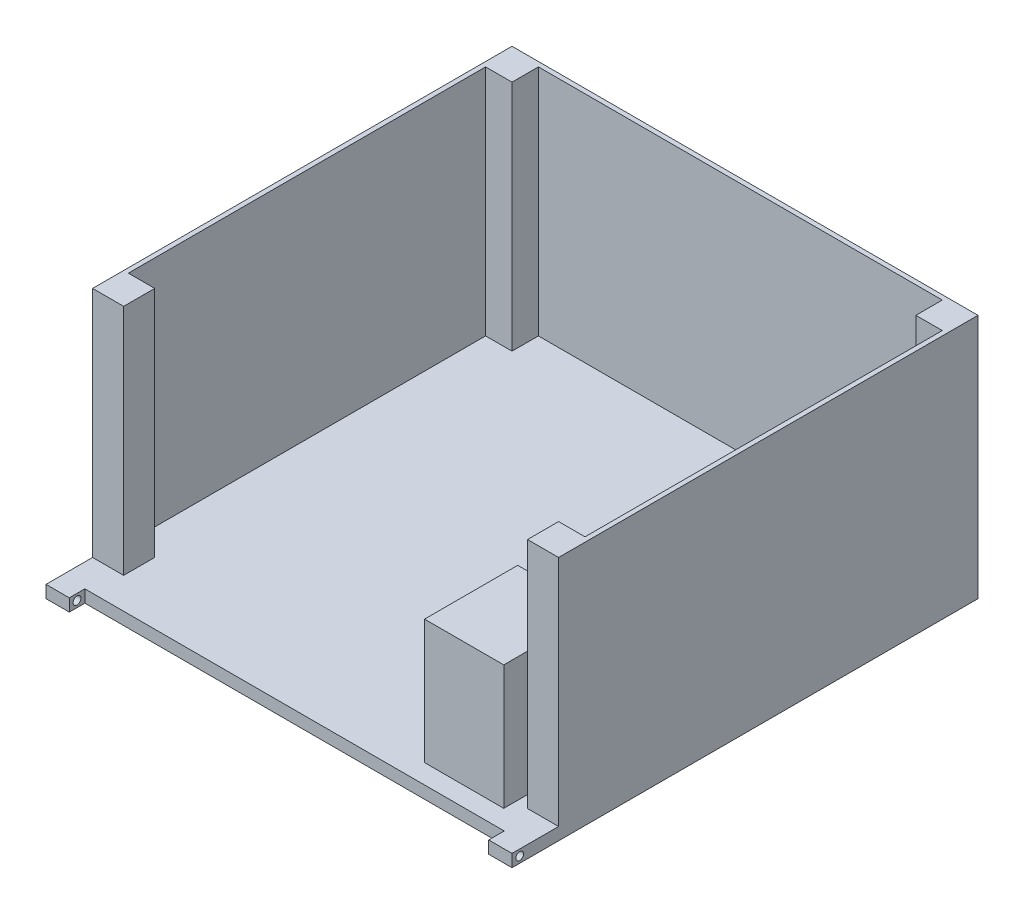
from build123d import *

# Parameters (mm, degrees)
BOSS_EXTRUDE1_DEPTH     = 8
CUT_EXTRUDE1_DEPTH      = 213.282830205
CUT_EXTRUDE1_DEPTH_BACK = 213.282830205
SKETCH2_R               = 2.5
SKETCH3_W               = 20
SKETCH3_H               = 20
BOSS_EXTRUDE2_DEPTH     = 150
BOSS_EXTRUDE3_DEPTH     = 150
SKETCH5_W               = 51
SKETCH5_H               = 60
BOSS_EXTRUDE4_DEPTH     = 80
SKETCH7_R               = 4
BOSS_EXTRUDE5_DEPTH     = 20


with BuildPart() as part:
    # Sketch1 → Boss-Extrude1 (new body)
    with BuildSketch(Plane(origin=(0, 0, 0), x_dir=(1, 0, 0), z_dir=(0, 1, 0))):
        Polygon((135, -150), (150, -150), (150, 150), (-150, 150), (-150, -150), (-135, -150), (-135, -140), (135, -140), align=None)
    extrude(amount=BOSS_EXTRUDE1_DEPTH)

    # Sketch2 → Cut-Extrude1 (cut, two sides: drawn at the far end of the back side and taken through both)
    with BuildSketch(Plane(origin=(0, 0, 0), x_dir=(0, 0, -1), z_dir=(1, 0, 0)).offset(-CUT_EXTRUDE1_DEPTH_BACK)):
        with Locations((-145.033528283, 4)):
            Circle(SKETCH2_R)
    extrude(amount=CUT_EXTRUDE1_DEPTH + CUT_EXTRUDE1_DEPTH_BACK, mode=Mode.SUBTRACT)

    # Sketch3 → Boss-Extrude2 (add)
    with BuildSketch(Plane(origin=(0, 8, 0), x_dir=(1, 0, 0), z_dir=(0, 1, 0))):
        with Locations((-140, 140)):
            Rectangle(SKETCH3_W, SKETCH3_H)
        with Locations((140, 140)):
            Rectangle(SKETCH3_W, SKETCH3_H)
        with Locations((140, -110)):
            Rectangle(SKETCH3_W, SKETCH3_H)
        with Locations((-140, -110)):
            Rectangle(SKETCH3_W, SKETCH3_H)
    extrude(amount=BOSS_EXTRUDE2_DEPTH)

    # Sketch4 → Boss-Extrude3 (add)
    with BuildSketch(Plane(origin=(0, 8, 0), x_dir=(1, 0, 0), z_dir=(0, 1, 0))):
        Polygon((-147, 147), (-147, -117), (-150, -120), (-150, 150), (150, 150), (150, -120), (147, -117), (147, 147), align=None)
    extrude(amount=BOSS_EXTRUDE3_DEPTH)

    # Sketch5 → Boss-Extrude4 (add)
    with BuildSketch(Plane(origin=(0, 8, 0), x_dir=(1, 0, 0), z_dir=(0, 1, 0))):
        with Locations((96.729689643, -97.534797701)):
            Rectangle(SKETCH5_W, SKETCH5_H)
    extrude(amount=BOSS_EXTRUDE4_DEPTH)

    # Sketch7 → Boss-Extrude5 (add)
    with BuildSketch(Plane.ZY.offset(-71.229689643)):
        with Locations(Location((97.642468488, 48, 0), (0, 0, 180))):
            Circle(SKETCH7_R)
    extrude(amount=BOSS_EXTRUDE5_DEPTH)


solid = part.part
